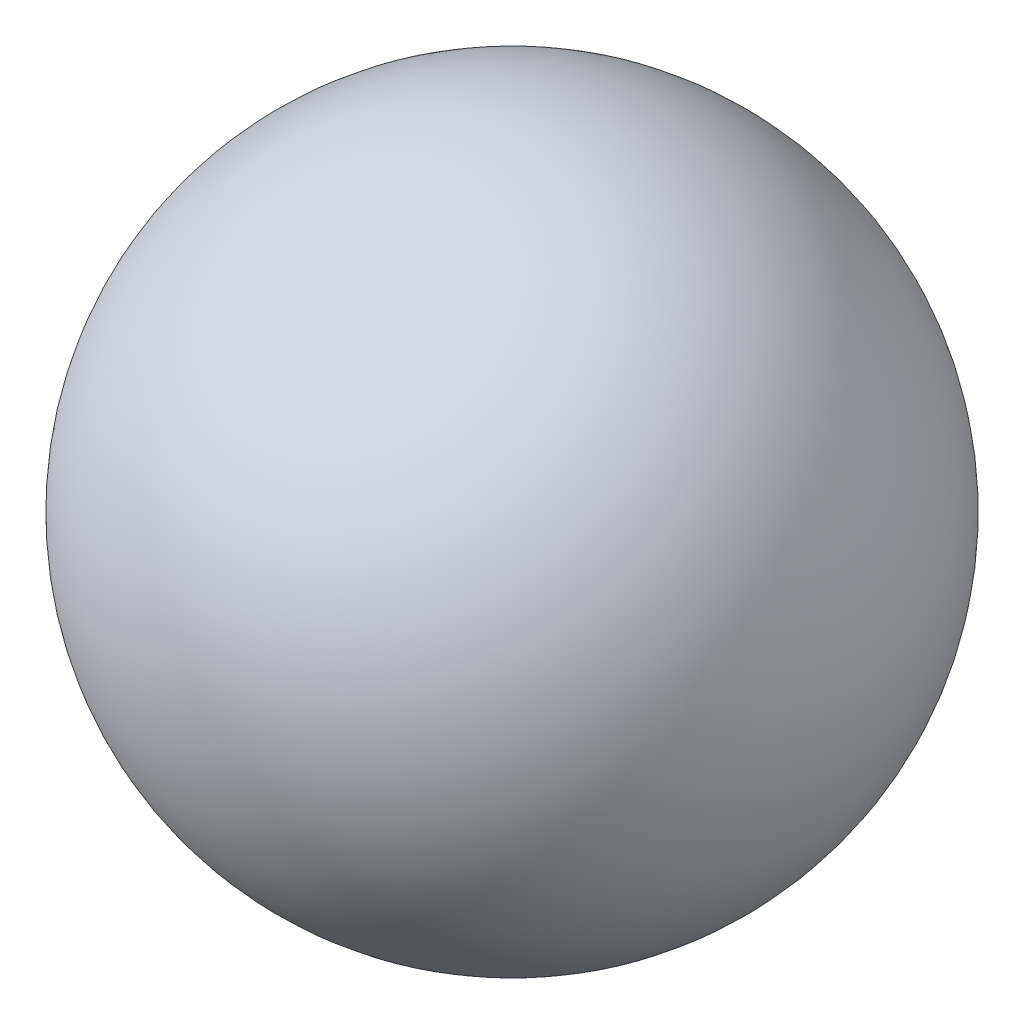
from build123d import *


with BuildPart() as part:
    # Sketch1 → Revolve1 (revolve)
    with BuildSketch(Plane.XY):
        with BuildLine():
            Line((0, 11.5), (0, -11.5))
            ThreePointArc((0, -11.5), (11.5, 0), (0, 11.5))
        make_face()
    revolve(axis=Axis((0, 11.5, 0), (0, -1, 0)))


solid = part.part
